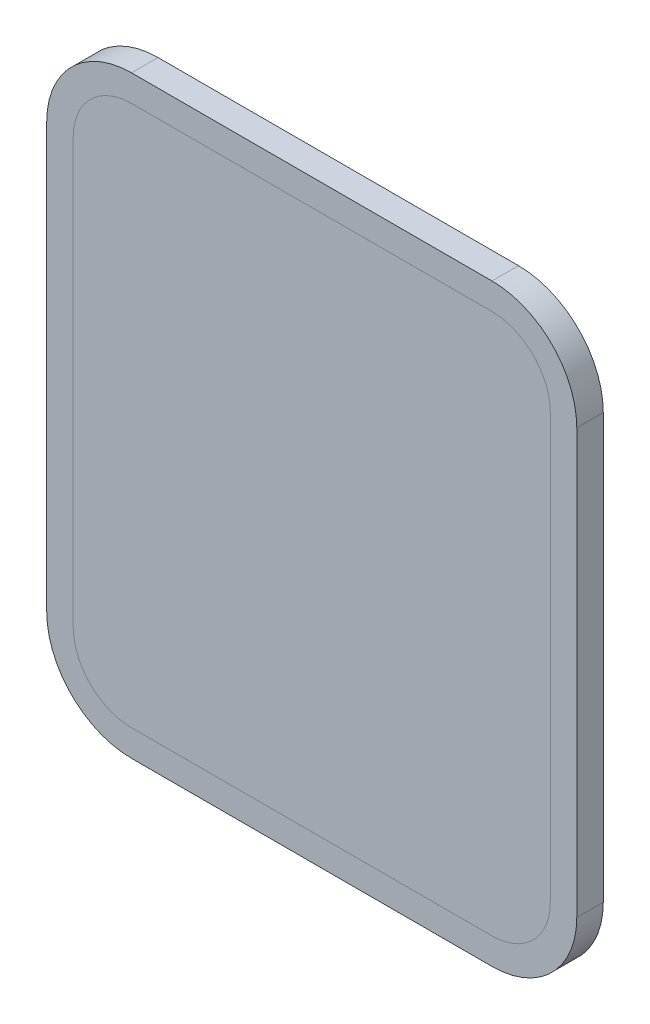
from build123d import *

# Parameters (mm, degrees)
BOSS_EXTRUDE1_DEPTH = 50
CUT_EXTRUDE1_REACH  = 1504.298
BOSS_EXTRUDE3_DEPTH = 50


with BuildPart() as part:
    # Sketch1 → Boss-Extrude1 (new body)
    with BuildSketch(Plane.XY):
        with BuildLine():
            Line((160, 0), (840, 0))
            ThreePointArc((840, 0), (953.13708499, 46.86291501), (1000, 160))
            Line((1000, 160), (1000, 960))
            ThreePointArc((1000, 960), (953.13708499, 1073.13708499), (840, 1120))
            Line((840, 1120), (160, 1120))
            ThreePointArc((160, 1120), (46.86291501, 1073.13708499), (0, 960))
            Line((0, 960), (0, 160))
            ThreePointArc((0, 160), (46.86291501, 46.86291501), (160, 0))
        make_face()
    extrude(amount=BOSS_EXTRUDE1_DEPTH)

    # Sketch3 → Cut-Extrude1 (cut, up to next)
    with BuildSketch(Plane.XY.offset(50), mode=Mode.PRIVATE) as cut_extrude1_sk1:
        with BuildLine():
            Line((160, 50), (840, 50))
            ThreePointArc((840, 50), (917.781745931, 82.218254069), (950, 160))
            Line((950, 160), (950, 960))
            ThreePointArc((950, 960), (917.781745931, 1037.781745931), (840, 1070))
            Line((840, 1070), (160, 1070))
            ThreePointArc((160, 1070), (82.218254069, 1037.781745931), (50, 960))
            Line((50, 960), (50, 160))
            ThreePointArc((50, 160), (82.218254069, 82.218254069), (160, 50))
        make_face()
    cut_extrude1_tool1 = extrude(cut_extrude1_sk1.sketch, amount=-CUT_EXTRUDE1_REACH, mode=Mode.PRIVATE) & part.part
    add(cut_extrude1_tool1.solids().sort_by_distance((500, 560, 50))[0], mode=Mode.SUBTRACT)


with BuildPart() as body_2:
    # Sketch3<2> → Boss-Extrude3 (new body)
    with BuildSketch(Plane.XY.offset(50)):
        with BuildLine():
            Line((160, 50), (840, 50))
            ThreePointArc((840, 50), (917.781745931, 82.218254069), (950, 160))
            Line((950, 160), (950, 960))
            ThreePointArc((950, 960), (917.781745931, 1037.781745931), (840, 1070))
            Line((840, 1070), (160, 1070))
            ThreePointArc((160, 1070), (82.218254069, 1037.781745931), (50, 960))
            Line((50, 960), (50, 160))
            ThreePointArc((50, 160), (82.218254069, 82.218254069), (160, 50))
        make_face()
    extrude(amount=-BOSS_EXTRUDE3_DEPTH)


solid = Compound([part.part, body_2.part])
